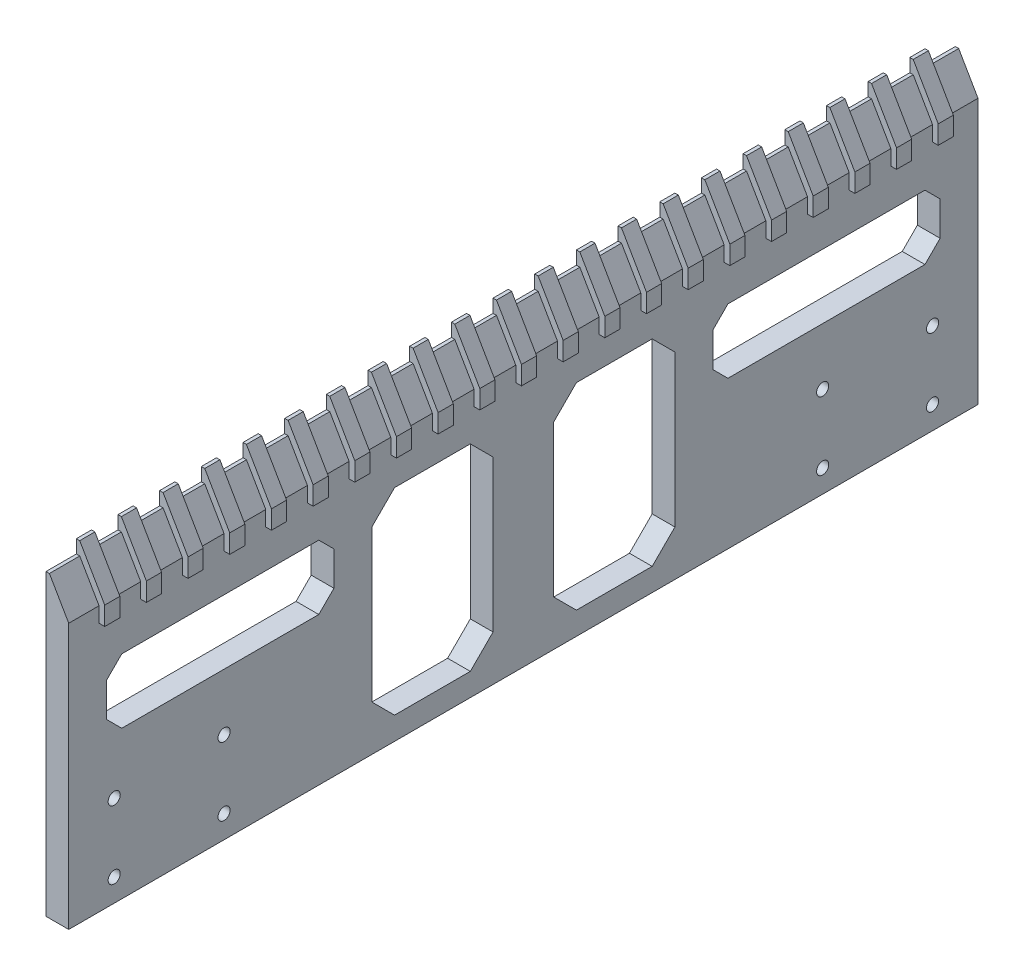
from build123d import *

# Parameters (mm, degrees)
SKETCH_1_W                 = 240
SKETCH_1_H                 = 70
EXTRUDE_1_DEPTH            = 6
CUT_EXTRUDE_2_DEPTH        = 251.071989635
EXTRUDE_2_DEPTH            = 240
EXTRUDE_3_DEPTH            = 2
PATTERN_LINEAR_1_COUNT     = 11
PATTERN_LINEAR_1_PITCH     = 11
PATTERN_LINEAR_1_COL_COUNT = 11
PATTERN_LINEAR_1_COL_PITCH = 11
HOLE_WIZARD_1_D            = 3.2
HOLE_WIZARD_1_CBORE_D      = 6
HOLE_WIZARD_1_CBORE_DEPTH  = 3.4


with BuildPart() as part:
    # 草图1 → 凸台-拉伸1 (new body)
    with BuildSketch(Plane(origin=(0, 0, 0), x_dir=(0, 0, -1), z_dir=(1, 0, 0))):
        with Locations((120, -35)):
            Rectangle(SKETCH_1_W, SKETCH_1_H)
    extrude(amount=EXTRUDE_1_DEPTH)

    # 草图3 → 切除-拉伸2 (cut, through all)
    with BuildSketch(Plane(origin=(6, 0, 0), x_dir=(0, 0, -1), z_dir=(1, 0, 0))):
        Polygon((14, -14), (66, -14), (70, -18), (70, -27), (66, -31), (14, -31), (10, -27), (10, -18), align=None)
        Polygon((80, -18), (86, -12), (106, -12), (112, -18), (112, -58), (106, -64), (86, -64), (80, -58), align=None)
    cut_extrude_2 = extrude(amount=-CUT_EXTRUDE_2_DEPTH, mode=Mode.SUBTRACT)

    # 草图6 → 凸台-拉伸2 (add)
    with BuildSketch(Plane.XY):
        Polygon((6, 0), (0, 0), (0, 8.833459119), (0.9, 8.833459119), align=None)
    extrude(amount=-EXTRUDE_2_DEPTH)

    # 草图8 → 凸台-拉伸3 (add, symmetric)
    with BuildSketch(Plane.XY.offset(-120)):
        Polygon((0, 10.392304845), (0, 12.333459119), (0.9, 12.333459119), (7.5, 0.901923789), (7.5, -4), (6, -4), (6, 0), (0.9, 8.833459119), (0, 8.833459119), align=None)
    extrude_3 = extrude(amount=EXTRUDE_3_DEPTH, both=True)

    # 阵列(线性)1: 凸台-拉伸3 ×11
    with Locations(*[(0, 0, i * PATTERN_LINEAR_1_PITCH) for i in range(1, PATTERN_LINEAR_1_COUNT)]):
        add(extrude_3)

    # 阵列(线性)1 col: 凸台-拉伸3 ×11
    with Locations(*[(0, 0, -i * PATTERN_LINEAR_1_COL_PITCH) for i in range(1, PATTERN_LINEAR_1_COL_COUNT)]):
        add(extrude_3)

    # 打孔尺寸(%根据)内六角圆柱头螺钉的类型1 (through all)
    with Locations(Plane.ZY):
        with Locations((-41, -46), (-12, -46), (-12, -64), (-41, -64)):
            hole_wizard_1 = CounterBoreHole(HOLE_WIZARD_1_D / 2, HOLE_WIZARD_1_CBORE_D / 2, HOLE_WIZARD_1_CBORE_DEPTH)

    # 镜向1: 打孔尺寸(%根据)内六角圆柱头螺钉的类型1 across plane
    add(hole_wizard_1.mirror(Plane.XY.offset(-120)), mode=Mode.SUBTRACT)

    # 镜向2: 切除-拉伸2 across plane
    add(cut_extrude_2.mirror(Plane.XY.offset(-120)), mode=Mode.SUBTRACT)


solid = part.part
